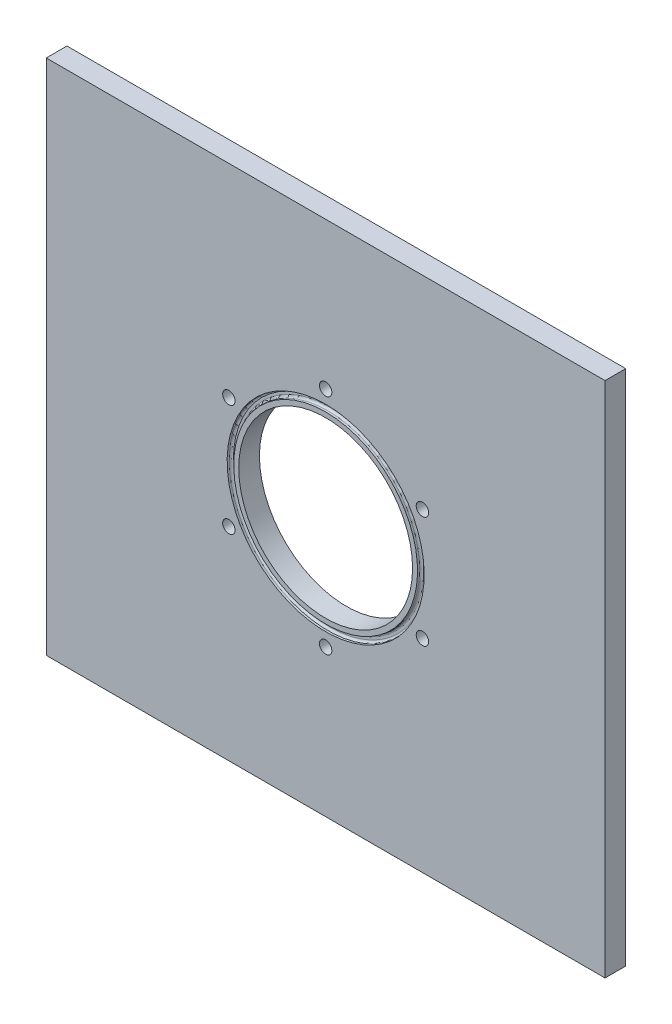
from build123d import *

# Parameters (mm, degrees)
SKETCH1_W           = 135
SKETCH1_H           = 125
SKETCH1_R           = 21
BOSS_EXTRUDE1_DEPTH = 5
CUT_EXTRUDE1_START  = 5
SKETCH1_3_R         = 1.5
CUT_EXTRUDE1_DEPTH  = 3
SKETCH2_R           = 1.5
CUT_EXTRUDE2_DEPTH  = 3


with BuildPart() as part:
    # Sketch1 → Boss-Extrude1 (new body)
    with BuildSketch(Plane.XY):
        Rectangle(SKETCH1_W, SKETCH1_H)
        Circle(SKETCH1_R, mode=Mode.SUBTRACT)
    extrude(amount=BOSS_EXTRUDE1_DEPTH)

    # Sketch1<3> → Cut-Extrude1 (cut)
    with BuildSketch(Plane.XY.offset(CUT_EXTRUDE1_START)):
        with Locations((0, 27)):
            Circle(SKETCH1_3_R)
        with Locations((23.382685902, 13.5)):
            Circle(SKETCH1_3_R)
        with Locations((23.382685902, -13.5)):
            Circle(SKETCH1_3_R)
        with Locations((0, -27)):
            Circle(SKETCH1_3_R)
        with Locations((-23.382685902, -13.5)):
            Circle(SKETCH1_3_R)
        with Locations((-23.382685902, 13.5)):
            Circle(SKETCH1_3_R)
    extrude(amount=-CUT_EXTRUDE1_DEPTH, mode=Mode.SUBTRACT)

    # Sketch2 → Cut-Extrude2 (cut)
    with BuildSketch(Plane(origin=(0, 0, 0), x_dir=(-1, 0, 0), z_dir=(0, 0, -1))):
        with Locations((27, 0)):
            Circle(SKETCH2_R)
        with Locations((-27, 0)):
            Circle(SKETCH2_R)
    extrude(amount=-CUT_EXTRUDE2_DEPTH, mode=Mode.SUBTRACT)

    # Sketch3 → Cut-Revolve1 (revolve, cut)
    with BuildSketch(Plane(origin=(0, 0, 0), x_dir=(0, 0, -1), z_dir=(1, 0, 0))):
        with BuildLine():
            Line((-5, 23.8), (-4.5, 23.8))
            ThreePointArc((-4.5, 23.8), (-4.146446609, 23.653553391), (-4, 23.3))
            Line((-4, 23.3), (-4, 22.7))
            ThreePointArc((-4, 22.7), (-4.146446609, 22.346446609), (-4.5, 22.2))
            Line((-4.5, 22.2), (-5, 22.2))
            Line((-5, 22.2), (-5, 23.8))
        make_face()
    revolve(axis=Axis((0, 0, 0), (0, 0, 1)), mode=Mode.SUBTRACT)


solid = part.part
